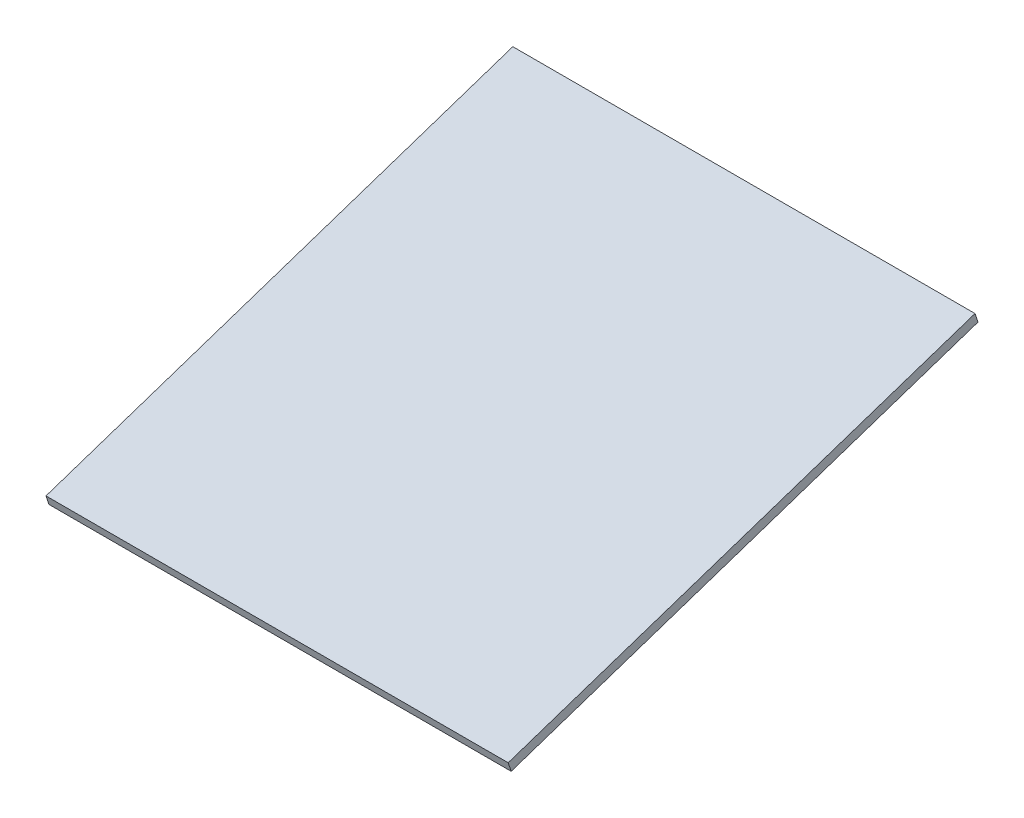
from build123d import *

# Parameters (mm, degrees)
SALIENTE_EXTRUIR1_DEPTH = 140
SALIENTE_EXTRUIR2_START = 13.3
SALIENTE_EXTRUIR2_DEPTH = 8
SALIENTE_EXTRUIR3_START = 119
SALIENTE_EXTRUIR3_DEPTH = 8


with BuildPart() as part:
    # Croquis1 → Saliente-Extruir1 (new body)
    with BuildSketch(Plane(origin=(0, 0, 0), x_dir=(0, 0, -1), z_dir=(1, 0, 0))):
        Polygon((-71.151247354, -22.217082451), (-70.251247354, -24.917082451), (-39.651247354, -14.717082451), (57.348752646, 17.616250882), (71.151247354, 22.217082451), (70.251247354, 24.917082451), align=None)
    extrude(amount=SALIENTE_EXTRUIR1_DEPTH)

    # Croquis1<3> → Saliente-Extruir2 (add)
    with BuildSketch(Plane(origin=(0, 0, 0), x_dir=(0, 0, -1), z_dir=(1, 0, 0)).offset(SALIENTE_EXTRUIR2_START)):
        Polygon((57.348752646, 17.616250882), (-39.651247354, -14.717082451), (-39.651247354, -22.717082451), (57.348752646, 9.616250882), align=None)
    extrude(amount=SALIENTE_EXTRUIR2_DEPTH)

    # Croquis1<4> → Saliente-Extruir3 (add)
    with BuildSketch(Plane(origin=(0, 0, 0), x_dir=(0, 0, -1), z_dir=(1, 0, 0)).offset(SALIENTE_EXTRUIR3_START)):
        Polygon((57.348752646, 17.616250882), (-39.651247354, -14.717082451), (-39.651247354, -22.717082451), (57.348752646, 9.616250882), align=None)
    extrude(amount=SALIENTE_EXTRUIR3_DEPTH)


solid = part.part
